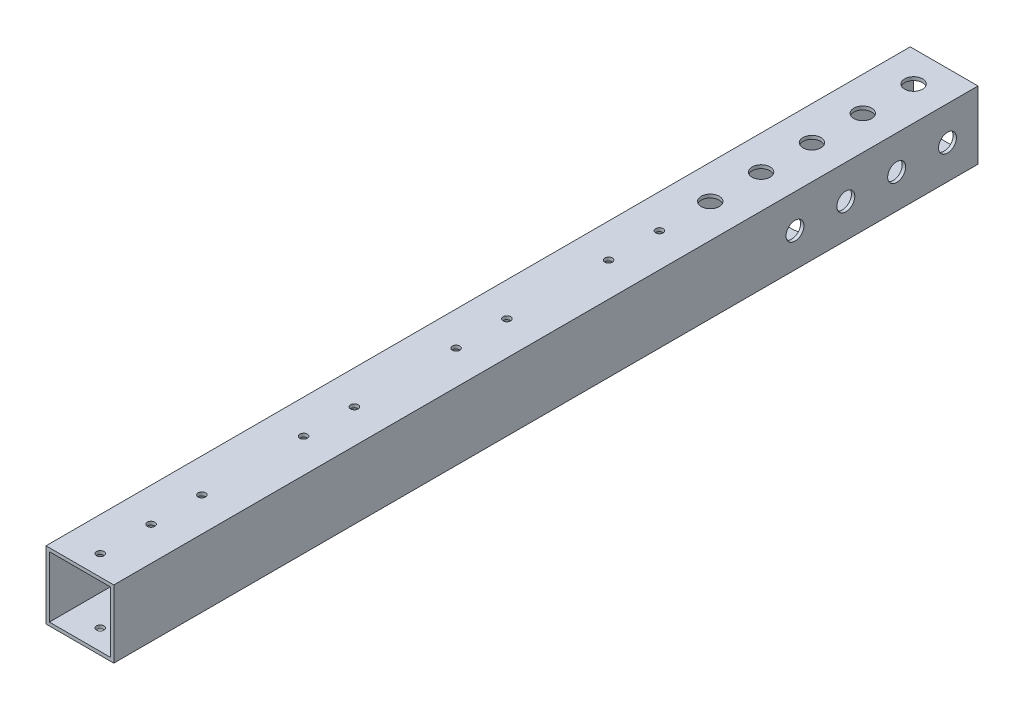
from build123d import *

# Parameters (mm, degrees)
SKETCH_1_W          = 20
SKETCH_1_H          = 20
SKETCH_1_W_2        = 18
SKETCH_1_H_2        = 18
EXTRUDE_2_DEPTH     = 255
SKETCH_2_R          = 2.65
SKETCH_2_R_2        = 1.1
CUT_EXTRUDE_1_DEPTH = 20
SKETCH_5_R          = 2.65
CUT_EXTRUDE_2_DEPTH = 20
SKETCH_6_R          = 6
CUT_EXTRUDE_3_DEPTH = 10


with BuildPart() as part:
    # 草图1 → 凸台-拉伸2 (new body)
    with BuildSketch(Plane.XY):
        with Locations((10, -10)):
            Rectangle(SKETCH_1_W, SKETCH_1_H)
        with Locations((10, -10)):
            Rectangle(SKETCH_1_W_2, SKETCH_1_H_2, mode=Mode.SUBTRACT)
    extrude(amount=EXTRUDE_2_DEPTH)

    # 草图2 → 切除-拉伸1 (cut)
    with BuildSketch(Plane(origin=(0, -20, 0), x_dir=(-1, 0, 0), z_dir=(0, -1, 0))):
        with Locations(Location((-10, -9, 0), (0, 0, 90))):
            Circle(SKETCH_2_R)
        with Locations(Location((-10, -24, 0), (0, 0, 90))):
            Circle(SKETCH_2_R)
        with Locations(Location((-10, -39, 0), (0, 0, 90))):
            Circle(SKETCH_2_R)
        with Locations(Location((-10, -54, 0), (0, 0, 90))):
            Circle(SKETCH_2_R)
        with Locations(Location((-10, -69, 0), (0, 0, 90))):
            Circle(SKETCH_2_R)
        with Locations(Location((-10, -99, 0), (0, 0, 90))):
            Circle(SKETCH_2_R_2)
        with Locations(Location((-10, -129, 0), (0, 0, 90))):
            Circle(SKETCH_2_R_2)
        with Locations(Location((-10, -144, 0), (0, 0, 90))):
            Circle(SKETCH_2_R_2)
        with Locations(Location((-10, -174, 0), (0, 0, 90))):
            Circle(SKETCH_2_R_2)
        with Locations(Location((-10, -189, 0), (0, 0, 90))):
            Circle(SKETCH_2_R_2)
        with Locations(Location((-10, -219, 0), (0, 0, 90))):
            Circle(SKETCH_2_R_2)
        with Locations(Location((-10, -234, 0), (0, 0, 90))):
            Circle(SKETCH_2_R_2)
        with Locations(Location((-10, -249, 0), (0, 0, 90))):
            Circle(SKETCH_2_R_2)
        with Locations(Location((-10, -84, 0), (0, 0, 90))):
            Circle(SKETCH_2_R_2)
    extrude(amount=-CUT_EXTRUDE_1_DEPTH, mode=Mode.SUBTRACT)

    # 草图5 → 切除-拉伸2 (cut)
    with BuildSketch(Plane.ZY):
        with Locations(Location((9, -10, 0), (0, 0, 270))):
            Circle(SKETCH_5_R)
        with Locations(Location((24, -10, 0), (0, 0, 270))):
            Circle(SKETCH_5_R)
        with Locations(Location((39, -10, 0), (0, 0, 270))):
            Circle(SKETCH_5_R)
        with Locations(Location((54, -10, 0), (0, 0, 270))):
            Circle(SKETCH_5_R)
    extrude(amount=-CUT_EXTRUDE_2_DEPTH, mode=Mode.SUBTRACT)

    # 草图6 → 切除-拉伸3 (cut)
    with BuildSketch(Plane(origin=(0, -20, 0), x_dir=(-1, 0, 0), z_dir=(0, -1, 0))):
        with Locations(Location((-10, -39, 0), (0, 0, 90))):
            Circle(SKETCH_6_R)
        with Locations(Location((-10, -54, 0), (0, 0, 90))):
            Circle(SKETCH_6_R)
        with Locations(Location((-10, -69, 0), (0, 0, 90))):
            Circle(SKETCH_6_R)
    extrude(amount=-CUT_EXTRUDE_3_DEPTH, mode=Mode.SUBTRACT)


solid = part.part
